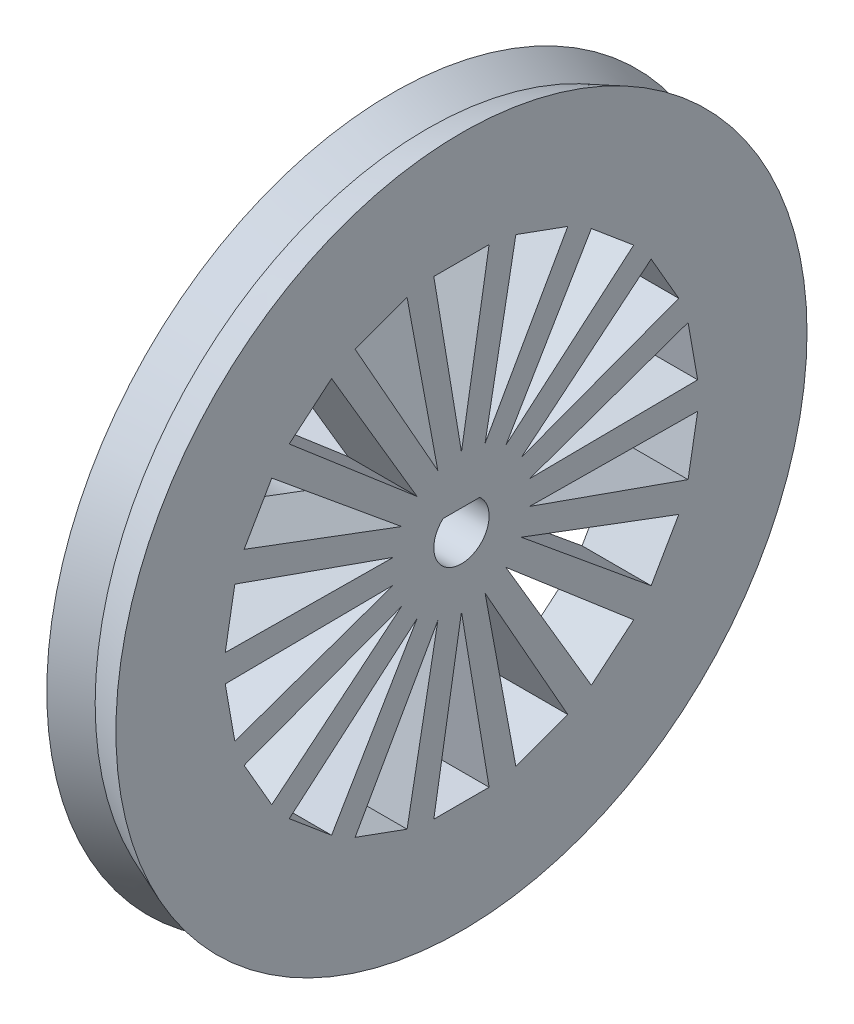
from build123d import *

# Parameters (mm, degrees)
CUT_EXTRUDE1_DEPTH  = 36.707142143
BOSS_EXTRUDE1_START = 5
BOSS_EXTRUDE1_DEPTH = 5
SKETCH7_R           = 0.75
CUT_EXTRUDE2_DEPTH  = 3


with BuildPart() as part:
    # Sketch4 → Revolve1 (revolve)
    with BuildSketch(Plane(origin=(0, 0, 0), x_dir=(1, 0, 0), z_dir=(0, 1, 0))):
        Polygon((0, 0), (0, 25), (2.5, 24), (5, 25), (5, 0), align=None)
    revolve(axis=Axis((5, 0, 0), (-1, 0, 0)))

    # Sketch5 → Cut-Extrude1 (cut, through all)
    with BuildSketch(Plane.ZY):
        Polygon((-15.722431864, 6.767949192), (-4.330127019, 2.5), (-13.722431864, 10.232050808), align=None)
        Polygon((-12.459478251, 11.737180314), (-3.213938048, 3.830222216), (-9.395300478, 14.308330752), align=None)
        Polygon((-7.693727678, 15.290734267), (-1.710100717, 4.698463104), (-3.934957195, 16.65881484), align=None)
        Polygon((0, 5), (2, 17), (-2, 17), align=None)
        Polygon((3.934957195, 16.65881484), (1.710100717, 4.698463104), (7.693727678, 15.290734267), align=None)
        Polygon((9.395300478, 14.308330752), (3.213938048, 3.830222216), (12.459478251, 11.737180314), align=None)
        Polygon((13.722431864, 10.232050808), (4.330127019, 2.5), (15.722431864, 6.767949192), align=None)
        Polygon((16.394435446, 4.921634526), (4.924038765, 0.868240888), (17.089028157, 0.982403514), align=None)
        Polygon((17.089028157, -0.982403514), (4.924038765, -0.868240888), (16.394435446, -4.921634526), align=None)
        Polygon((15.722431864, -6.767949192), (4.330127019, -2.5), (13.722431864, -10.232050808), align=None)
        Polygon((12.459478251, -11.737180314), (3.213938048, -3.830222216), (9.395300478, -14.308330752), align=None)
        Polygon((7.693727678, -15.290734267), (1.710100717, -4.698463104), (3.934957195, -16.65881484), align=None)
        Polygon((2, -17), (0, -5), (-2, -17), align=None)
        Polygon((-3.934957195, -16.65881484), (-1.710100717, -4.698463104), (-7.693727678, -15.290734267), align=None)
        Polygon((-9.395300478, -14.308330752), (-3.213938048, -3.830222216), (-12.459478251, -11.737180314), align=None)
        Polygon((-13.722431864, -10.232050808), (-4.330127019, -2.5), (-15.722431864, -6.767949192), align=None)
        Polygon((-16.394435446, -4.921634526), (-4.924038765, -0.868240888), (-17.089028157, -0.982403514), align=None)
        with BuildLine():
            ThreePointArc((-1.322875656, 1.5), (0, -2), (1.322875656, 1.5))
            Line((1.322875656, 1.5), (-1.322875656, 1.5))
        make_face()
        Polygon((-16.394435446, 4.921634526), (-17.089028157, 0.982403514), (-4.924038765, 0.868240888), align=None)
    extrude(amount=-CUT_EXTRUDE1_DEPTH, mode=Mode.SUBTRACT)

    # Sketch6 → Boss-Extrude1 (add)
    with BuildSketch(Plane.ZY.offset(BOSS_EXTRUDE1_START)):
        with BuildLine():
            Line((-3.570714214, 3.5), (3.570714214, 3.5))
            ThreePointArc((3.570714214, 3.5), (0, -5), (-3.570714214, 3.5))
        make_face()
        with BuildLine():
            Line((-1.322875656, 1.5), (1.322875656, 1.5))
            ThreePointArc((1.322875656, 1.5), (0, -2), (-1.322875656, 1.5))
        make_face(mode=Mode.SUBTRACT)
    extrude(amount=-BOSS_EXTRUDE1_DEPTH)

    # Sketch7 → Cut-Extrude2 (cut)
    with BuildSketch(Plane(origin=(0, 3.5, 0), x_dir=(1, 0, 0), z_dir=(0, 1, 0))):
        with Locations(Location((-3, 0, 0), (0, 0, 270))):
            Circle(SKETCH7_R)
    extrude(amount=-CUT_EXTRUDE2_DEPTH, mode=Mode.SUBTRACT)


solid = part.part
